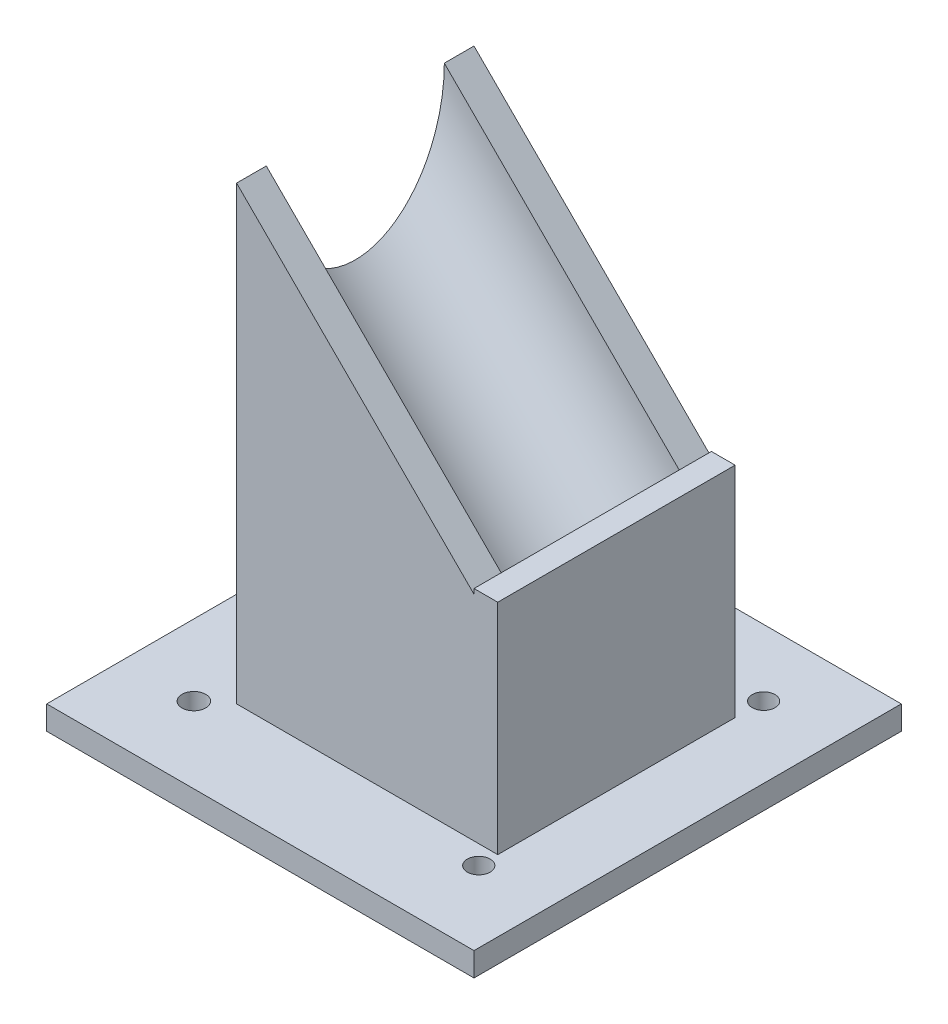
from build123d import *

# Parameters (mm, degrees)
SKETCH1_W               = 50
SKETCH1_H               = 50
BOSS_EXTRUDE1_DEPTH     = 50
BOSS_EXTRUDE2_DEPTH     = 50
SKETCH4_W               = 18.75
SKETCH4_H               = 70.710678119
CUT_EXTRUDE2_DEPTH      = 100
CUT_EXTRUDE2_DEPTH_BACK = 100
SKETCH5_R               = 18.75
SKETCH6_W               = 50
SKETCH6_H               = 50
BOSS_EXTRUDE3_DEPTH     = 5
SKETCH7_W               = 18.75
SKETCH7_H               = 70.710678119
SKETCH9_R               = 18.867934004
BOSS_EXTRUDE6_DEPTH     = 20
SKETCH10_W              = 50
SKETCH10_H              = 65.146880585
CUT_EXTRUDE3_DEPTH      = 40
CUT_EXTRUDE4_START      = -70
SKETCH11_R              = 18.75
CUT_EXTRUDE4_DEPTH      = 70
SKETCH12_W              = 50
SKETCH12_H              = 46.047099175
BOSS_EXTRUDE7_DEPTH     = 5
SKETCH13_R              = 2.4
SKETCH13_R_2            = 2.5
CUT_EXTRUDE5_DEPTH      = 5


with BuildPart() as part:
    # Sketch1 → Boss-Extrude1 (new body)
    with BuildSketch(Plane.XY):
        with Locations((-25, 25)):
            Rectangle(SKETCH1_W, SKETCH1_H)
    extrude(amount=BOSS_EXTRUDE1_DEPTH)

    # Sketch2 → Boss-Extrude2 (add)
    with BuildSketch(Plane.XY.offset(50)):
        Polygon((0, 50), (-50, 50), (-50, 100), align=None)
    extrude(amount=-BOSS_EXTRUDE2_DEPTH)

    # Sketch4 → Revolve1 (revolve)
    with BuildSketch(Plane(origin=(25, 25, 0), x_dir=(0, 0, -1), z_dir=(0.7071067811865477, 0.7071067811865475, 0))):
        with Locations((-34.375, 70.710678118)):
            Rectangle(SKETCH4_W, SKETCH4_H)
    revolve(axis=Axis((-50, 100, 25), (0.7071067811865475, -0.7071067811865477, 0)))

    # Sketch5 → Cut-Extrude2 (cut, two sides: drawn at the far end of the back side and taken through both)
    with BuildSketch(Plane(origin=(-25, 25, 0), x_dir=(0, 0, -1), z_dir=(0.7071067811865477, -0.7071067811865475, 0)).offset(-CUT_EXTRUDE2_DEPTH_BACK)):
        with Locations((-25, 35.355339059)):
            Circle(SKETCH5_R)
    extrude(amount=CUT_EXTRUDE2_DEPTH + CUT_EXTRUDE2_DEPTH_BACK, mode=Mode.SUBTRACT)

    # Sketch6 → Boss-Extrude3 (add)
    with BuildSketch(Plane.XZ):
        Polygon((-70, -20), (-50, -20), (20, -20), (20, 50), (20, 70), (0, 70), (-70, 70), (-70, 0), align=None)
        with Locations((-25, 25)):
            Rectangle(SKETCH6_W, SKETCH6_H, mode=Mode.SUBTRACT)
    extrude(amount=-BOSS_EXTRUDE3_DEPTH)

    # Sketch7 → Revolve2 (revolve)
    with BuildSketch(Plane(origin=(25, 25, 0), x_dir=(0, 0, -1), z_dir=(0.7071067811865477, 0.7071067811865475, 0))):
        with Locations((-34.375, 70.710678118)):
            Rectangle(SKETCH7_W, SKETCH7_H)
    revolve(axis=Axis((0, 50, 25), (-0.7071067811865475, 0.7071067811865477, 0)))

    # Sketch9 → Boss-Extrude6 (add)
    with BuildSketch(Plane(origin=(-25, 25, 0), x_dir=(0, 0, -1), z_dir=(0.7071067811865477, -0.7071067811865475, 0))):
        with Locations((-25.10968595, 35.312009835)):
            Circle(SKETCH9_R)
    extrude(amount=BOSS_EXTRUDE6_DEPTH)

    # Sketch10 → Cut-Extrude3 (cut)
    with BuildSketch(Plane(origin=(0, 0, 0), x_dir=(0, 0, -1), z_dir=(1, 0, 0))):
        with Locations((-25, 49.118259987)):
            Rectangle(SKETCH10_W, SKETCH10_H)
    extrude(amount=CUT_EXTRUDE3_DEPTH, mode=Mode.SUBTRACT)

    # Sketch11 → Cut-Extrude4 (cut)
    with BuildSketch(Plane(origin=(-75, 75, 0), x_dir=(0, 0, 1), z_dir=(-0.7071067811865477, 0.7071067811865475, 0)).offset(CUT_EXTRUDE4_START)):
        with Locations((25, 35.355339059)):
            Circle(SKETCH11_R)
    extrude(amount=CUT_EXTRUDE4_DEPTH, mode=Mode.SUBTRACT)

    # Sketch12 → Boss-Extrude7 (add)
    with BuildSketch(Plane(origin=(0, 0, 0), x_dir=(0, 0, -1), z_dir=(1, 0, 0))):
        with Locations((-25, 28.023549588)):
            Rectangle(SKETCH12_W, SKETCH12_H)
    extrude(amount=BOSS_EXTRUDE7_DEPTH)

    # Sketch13 → Cut-Extrude5 (cut)
    with BuildSketch(Plane(origin=(0, 5, 0), x_dir=(1, 0, 0), z_dir=(0, 1, 0))):
        with Locations((5, 6)):
            Circle(SKETCH13_R)
        with Locations((5, -54)):
            Circle(SKETCH13_R)
        with Locations((-55, 6)):
            Circle(SKETCH13_R_2)
        with Locations((-55, -54)):
            Circle(SKETCH13_R_2)
    extrude(amount=-CUT_EXTRUDE5_DEPTH, mode=Mode.SUBTRACT)


solid = part.part
